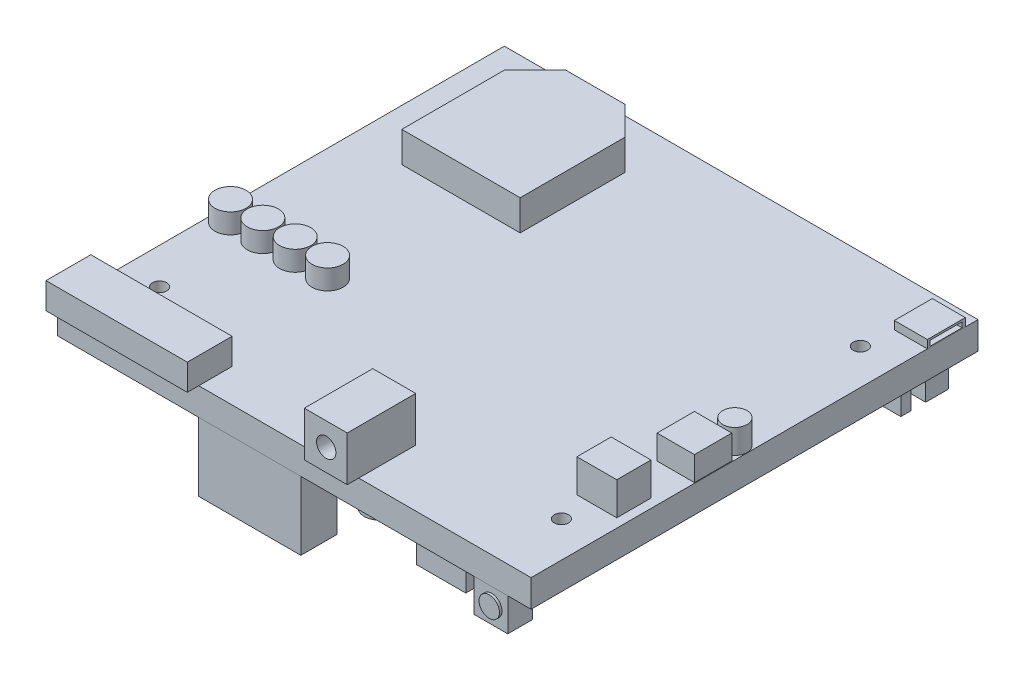
from build123d import *

# Parameters (mm, degrees)
SKETCH1_W             = 96.647
SKETCH1_H             = 91.186
BOSS_EXTRUDE1_DEPTH   = 5.588
BOSS_EXTRUDE2_DEPTH   = 6.223
SKETCH2_3_R           = 3.175
BOSS_EXTRUDE3_DEPTH   = 4.064
BOSS_EXTRUDE3_2_DEPTH = 4.064
BOSS_EXTRUDE3_3_DEPTH = 4.064
BOSS_EXTRUDE3_4_DEPTH = 4.064
SKETCH2_4_W           = 28.829
SKETCH2_4_H           = 6.8072
SKETCH2_4_H_2         = 2.3368
BOSS_EXTRUDE4_DEPTH   = 5.334
SKETCH2_5_W           = 8.763
SKETCH2_5_H           = 11.6332
SKETCH2_5_H_2         = 2.3368
BOSS_EXTRUDE5_DEPTH   = 9.144
SKETCH2_6_W           = 8.128
SKETCH2_6_H           = 6.985
BOSS_EXTRUDE6_DEPTH   = 6.731
SKETCH2_7_W           = 7.62
SKETCH2_7_H           = 7.62
BOSS_EXTRUDE7_DEPTH   = 4.953
SKETCH2_7_R           = 2.4765
BOSS_EXTRUDE7_2_DEPTH = 4.953
SKETCH2_8_W           = 6.731
SKETCH2_8_H           = 7.747
BOSS_EXTRUDE8_DEPTH   = 1.651
SKETCH3_W             = 20.32
SKETCH3_H             = 2.032
BOSS_EXTRUDE9_DEPTH   = 7.366
SKETCH3_H_2           = 4.699
BOSS_EXTRUDE9_2_DEPTH = 7.366
BOSS_EXTRUDE9_3_DEPTH = 7.366
BOSS_EXTRUDE9_4_DEPTH = 7.366
BOSS_EXTRUDE9_5_DEPTH = 7.366
BOSS_EXTRUDE9_6_DEPTH = 7.366
BOSS_EXTRUDE9_7_DEPTH = 7.366
BOSS_EXTRUDE9_8_DEPTH = 7.366
SKETCH4_W             = 20.828
SKETCH4_H             = 7.366
BOSS_EXTRUDE10_DEPTH  = 13.97
SKETCH5_W             = 25.019
SKETCH5_H             = 3.937
BOSS_EXTRUDE11_DEPTH  = 2.032
SKETCH6_R             = 3.048
BOSS_EXTRUDE12_DEPTH  = 6.35
SKETCH7_W             = 4.699
SKETCH7_H             = 4.699
BOSS_EXTRUDE13_DEPTH  = 1.651
SKETCH8_W             = 10.033
SKETCH8_H             = 10.033
BOSS_EXTRUDE14_DEPTH  = 5.08
SKETCH10_W            = 6.858
SKETCH10_H            = 5.08
BOSS_EXTRUDE15_DEPTH  = 6.731
SKETCH11_R            = 1.4605
CUT_EXTRUDE1_DEPTH    = 126.642876838
SKETCH13_W            = 6.502772336
SKETCH13_H            = 1.05238103
CUT_EXTRUDE3_DEPTH    = 2.54
SKETCH12_R            = 2.086347044
BOSS_EXTRUDE16_DEPTH  = 0.508
SKETCH14_R            = 1.973731767
CUT_EXTRUDE4_DEPTH    = 4.064


with BuildPart() as part:
    # Sketch1 → Boss-Extrude1 (new body)
    with BuildSketch(Plane(origin=(0, 0, 0), x_dir=(1, 0, 0), z_dir=(0, 1, 0))):
        with Locations((-36.848174165, 45.593)):
            Rectangle(SKETCH1_W, SKETCH1_H)
    extrude(amount=BOSS_EXTRUDE1_DEPTH)

    # Sketch2 → Boss-Extrude2 (add)
    with BuildSketch(Plane(origin=(0, 5.588, 0), x_dir=(1, 0, 0), z_dir=(0, 1, 0))):
        Polygon((-56.342674165, 86.995), (-50.551474165, 81.2038), (-50.551474165, 59.7916), (-74.706874165, 59.7916), (-74.706874165, 80.8482), (-68.560074165, 86.995), align=None)
    extrude(amount=BOSS_EXTRUDE2_DEPTH)

    # Sketch11 → Cut-Extrude1 (cut, through all)
    with BuildSketch(Plane.XZ):
        with Locations(Location((-77.818374165, -13.4747, 0), (0, 0, 270))):
            Circle(SKETCH11_R)
        with Locations(Location((-77.818374165, -74.4855, 0), (0, 0, 270))):
            Circle(SKETCH11_R)
        with Locations(Location((4.172825835, -74.4855, 0), (0, 0, 270))):
            Circle(SKETCH11_R)
        with Locations(Location((4.172825835, -13.4747, 0), (0, 0, 270))):
            Circle(SKETCH11_R)
    extrude(amount=-CUT_EXTRUDE1_DEPTH, mode=Mode.SUBTRACT)


with BuildPart() as body_2:
    # Sketch2<3> → Boss-Extrude3 (new body)
    with BuildSketch(Plane(origin=(0, 5.588, 0), x_dir=(1, 0, 0), z_dir=(0, 1, 0))):
        with Locations(Location((-81.996674165, 32.131, 0), (0, 0, 270))):
            Circle(SKETCH2_3_R)
    extrude(amount=BOSS_EXTRUDE3_DEPTH)


with BuildPart() as body_3:
    # Sketch2<3> → Boss-Extrude3 2 (new body)
    with BuildSketch(Plane(origin=(0, 5.588, 0), x_dir=(1, 0, 0), z_dir=(0, 1, 0))):
        with Locations(Location((-75.392674165, 32.131, 0), (0, 0, 270))):
            Circle(SKETCH2_3_R)
    extrude(amount=BOSS_EXTRUDE3_2_DEPTH)


with BuildPart() as body_4:
    # Sketch2<3> → Boss-Extrude3 3 (new body)
    with BuildSketch(Plane(origin=(0, 5.588, 0), x_dir=(1, 0, 0), z_dir=(0, 1, 0))):
        with Locations(Location((-68.788674165, 32.131, 0), (0, 0, 270))):
            Circle(SKETCH2_3_R)
    extrude(amount=BOSS_EXTRUDE3_3_DEPTH)


with BuildPart() as body_5:
    # Sketch2<3> → Boss-Extrude3 4 (new body)
    with BuildSketch(Plane(origin=(0, 5.588, 0), x_dir=(1, 0, 0), z_dir=(0, 1, 0))):
        with Locations(Location((-62.184674165, 32.131, 0), (0, 0, 270))):
            Circle(SKETCH2_3_R)
    extrude(amount=BOSS_EXTRUDE3_4_DEPTH)


with BuildPart() as body_6:
    # Sketch2<4> → Boss-Extrude4 (new body)
    with BuildSketch(Plane(origin=(0, 5.588, 0), x_dir=(1, 0, 0), z_dir=(0, 1, 0))):
        with Locations((-70.757174165, 3.4036)):
            Rectangle(SKETCH2_4_W, SKETCH2_4_H)
        with Locations((-70.757174165, -1.1684)):
            Rectangle(SKETCH2_4_W, SKETCH2_4_H_2)
    extrude(amount=BOSS_EXTRUDE4_DEPTH)


with BuildPart() as body_7:
    # Sketch2<5> → Boss-Extrude5 (new body)
    with BuildSketch(Plane(origin=(0, 5.588, 0), x_dir=(1, 0, 0), z_dir=(0, 1, 0))):
        with Locations((-28.085174165, 5.8166)):
            Rectangle(SKETCH2_5_W, SKETCH2_5_H)
        with Locations((-28.085174165, -1.1684)):
            Rectangle(SKETCH2_5_W, SKETCH2_5_H_2)
    extrude(amount=BOSS_EXTRUDE5_DEPTH)

    # Sketch14 → Cut-Extrude4 (cut)
    with BuildSketch(Plane.XY.offset(2.3368)):
        with Locations((-27.995813949, 10.054523758)):
            Circle(SKETCH14_R)
    extrude(amount=-CUT_EXTRUDE4_DEPTH, mode=Mode.SUBTRACT)


with BuildPart() as body_8:
    # Sketch2<6> → Boss-Extrude6 (new body)
    with BuildSketch(Plane(origin=(0, 5.588, 0), x_dir=(1, 0, 0), z_dir=(0, 1, 0))):
        with Locations((5.582525835, 22.7965)):
            Rectangle(SKETCH2_6_W, SKETCH2_6_H)
    extrude(amount=BOSS_EXTRUDE6_DEPTH)


with BuildPart() as body_9:
    # Sketch2<7> → Boss-Extrude7 (new body)
    with BuildSketch(Plane(origin=(0, 5.588, 0), x_dir=(1, 0, 0), z_dir=(0, 1, 0))):
        with Locations((7.538325835, 37.2618)):
            Rectangle(SKETCH2_7_W, SKETCH2_7_H)
    extrude(amount=BOSS_EXTRUDE7_DEPTH)


with BuildPart() as body_10:
    # Sketch2<7> → Boss-Extrude7 2 (new body)
    with BuildSketch(Plane(origin=(0, 5.588, 0), x_dir=(1, 0, 0), z_dir=(0, 1, 0))):
        with Locations(Location((8.935325835, 44.1198, 0), (0, 0, 270))):
            Circle(SKETCH2_7_R)
    extrude(amount=BOSS_EXTRUDE7_2_DEPTH)


with BuildPart() as body_11:
    # Sketch2<8> → Boss-Extrude8 (new body)
    with BuildSketch(Plane(origin=(0, 5.588, 0), x_dir=(1, 0, 0), z_dir=(0, 1, 0))):
        with Locations((8.109825835, 84.7217)):
            Rectangle(SKETCH2_8_W, SKETCH2_8_H)
    extrude(amount=BOSS_EXTRUDE8_DEPTH)

    # Sketch13 → Cut-Extrude3 (cut)
    with BuildSketch(Plane(origin=(11.475325835, 0, 0), x_dir=(0, 0, -1), z_dir=(1, 0, 0))):
        with Locations((84.686002297, 6.299052732)):
            Rectangle(SKETCH13_W, SKETCH13_H)
    extrude(amount=-CUT_EXTRUDE3_DEPTH, mode=Mode.SUBTRACT)


with BuildPart() as body_12:
    # Sketch3 → Boss-Extrude9 (new body)
    with BuildSketch(Plane.XZ):
        with Locations((-71.328674165, -80.137)):
            Rectangle(SKETCH3_W, SKETCH3_H)
    extrude(amount=BOSS_EXTRUDE9_DEPTH)


with BuildPart() as body_13:
    # Sketch3 → Boss-Extrude9 2 (new body)
    with BuildSketch(Plane.XZ):
        with Locations((-71.328674165, -86.5505)):
            Rectangle(SKETCH3_W, SKETCH3_H_2)
    extrude(amount=BOSS_EXTRUDE9_2_DEPTH)


with BuildPart() as body_14:
    # Sketch3 → Boss-Extrude9 3 (new body)
    with BuildSketch(Plane.XZ):
        with Locations((-48.341674165, -80.137)):
            Rectangle(SKETCH3_W, SKETCH3_H)
    extrude(amount=BOSS_EXTRUDE9_3_DEPTH)


with BuildPart() as body_15:
    # Sketch3 → Boss-Extrude9 4 (new body)
    with BuildSketch(Plane.XZ):
        with Locations((-48.341674165, -86.5505)):
            Rectangle(SKETCH3_W, SKETCH3_H_2)
    extrude(amount=BOSS_EXTRUDE9_4_DEPTH)


with BuildPart() as body_16:
    # Sketch3 → Boss-Extrude9 5 (new body)
    with BuildSketch(Plane.XZ):
        with Locations((-25.354674165, -80.137)):
            Rectangle(SKETCH3_W, SKETCH3_H)
    extrude(amount=BOSS_EXTRUDE9_5_DEPTH)


with BuildPart() as body_17:
    # Sketch3 → Boss-Extrude9 6 (new body)
    with BuildSketch(Plane.XZ):
        with Locations((-25.354674165, -86.5505)):
            Rectangle(SKETCH3_W, SKETCH3_H_2)
    extrude(amount=BOSS_EXTRUDE9_6_DEPTH)


with BuildPart() as body_18:
    # Sketch3 → Boss-Extrude9 7 (new body)
    with BuildSketch(Plane.XZ):
        with Locations((-2.367674165, -80.137)):
            Rectangle(SKETCH3_W, SKETCH3_H)
    extrude(amount=BOSS_EXTRUDE9_7_DEPTH)


with BuildPart() as body_19:
    # Sketch3 → Boss-Extrude9 8 (new body)
    with BuildSketch(Plane.XZ):
        with Locations((-2.367674165, -86.5505)):
            Rectangle(SKETCH3_W, SKETCH3_H_2)
    extrude(amount=BOSS_EXTRUDE9_8_DEPTH)


with BuildPart() as body_20:
    # Sketch4 → Boss-Extrude10 (new body)
    with BuildSketch(Plane.XZ):
        with Locations((-45.928674165, -3.683)):
            Rectangle(SKETCH4_W, SKETCH4_H)
    extrude(amount=BOSS_EXTRUDE10_DEPTH)


with BuildPart() as body_21:
    # Sketch5 → Boss-Extrude11 (new body)
    with BuildSketch(Plane.XZ):
        with Locations((-36.721174165, -48.9585)):
            Rectangle(SKETCH5_W, SKETCH5_H)
    extrude(amount=BOSS_EXTRUDE11_DEPTH)


with BuildPart() as body_22:
    # Sketch6 → Boss-Extrude12 (new body)
    with BuildSketch(Plane.XZ):
        with Locations(Location((-28.275674165, -8.763, 0), (0, 0, 270))):
            Circle(SKETCH6_R)
    extrude(amount=BOSS_EXTRUDE12_DEPTH)


with BuildPart() as body_23:
    # Sketch7 → Boss-Extrude13 (new body)
    with BuildSketch(Plane.XZ):
        with Locations((-20.719174165, -9.4615)):
            Rectangle(SKETCH7_W, SKETCH7_H)
    extrude(amount=BOSS_EXTRUDE13_DEPTH)


with BuildPart() as body_24:
    # Sketch8 → Boss-Extrude14 (new body)
    with BuildSketch(Plane.XZ):
        with Locations((-8.146174165, -6.2865)):
            Rectangle(SKETCH8_W, SKETCH8_H)
    extrude(amount=BOSS_EXTRUDE14_DEPTH)


with BuildPart() as body_25:
    # Sketch10 → Boss-Extrude15 (new body)
    with BuildSketch(Plane.XZ):
        with Locations((3.283825835, -2.54)):
            Rectangle(SKETCH10_W, SKETCH10_H)
    extrude(amount=BOSS_EXTRUDE15_DEPTH)

    # Sketch12 → Boss-Extrude16 (add)
    with BuildSketch(Plane.XY):
        with Locations(Location((3.443826311, -3.295057074, 0), (0, 0, 180))):
            Circle(SKETCH12_R)
    extrude(amount=BOSS_EXTRUDE16_DEPTH)


solid = Compound([part.part, body_2.part, body_3.part, body_4.part, body_5.part, body_6.part, body_7.part, body_8.part, body_9.part, body_10.part, body_11.part, body_12.part, body_13.part, body_14.part, body_15.part, body_16.part, body_17.part, body_18.part, body_19.part, body_20.part, body_21.part, body_22.part, body_23.part, body_24.part, body_25.part])
